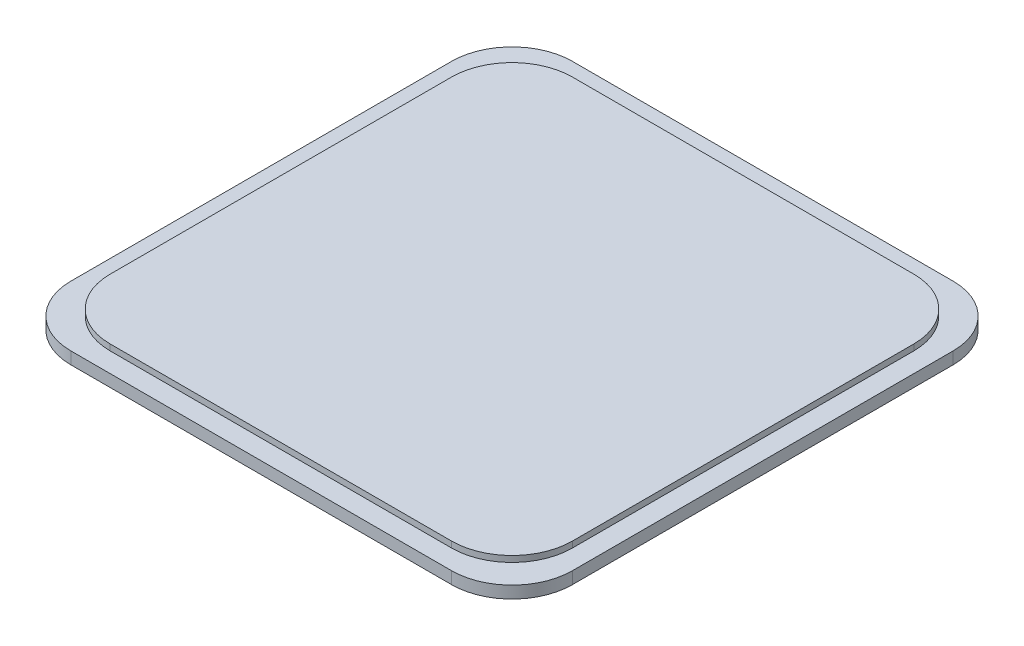
from build123d import *

# Parameters (mm, degrees)
BOSS_EXTRUDE1_DEPTH = 2
BOSS_EXTRUDE2_DEPTH = 1


with BuildPart() as part:
    # Sketch1 → Boss-Extrude1 (new body)
    with BuildSketch(Plane(origin=(0, 0, 0), x_dir=(1, 0, 0), z_dir=(0, 1, 0))):
        with BuildLine():
            Line((-31.5, 41.5), (31.5, 41.5))
            ThreePointArc((31.5, 41.5), (38.571067812, 38.571067812), (41.5, 31.5))
            Line((41.5, 31.5), (41.5, -31.5))
            ThreePointArc((41.5, -31.5), (38.571067812, -38.571067812), (31.5, -41.5))
            Line((31.5, -41.5), (-31.5, -41.5))
            ThreePointArc((-31.5, -41.5), (-38.571067812, -38.571067812), (-41.5, -31.5))
            Line((-41.5, -31.5), (-41.5, 31.5))
            ThreePointArc((-41.5, 31.5), (-38.571067812, 38.571067812), (-31.5, 41.5))
        make_face()
    extrude(amount=BOSS_EXTRUDE1_DEPTH)

    # Sketch2 → Boss-Extrude2 (add)
    with BuildSketch(Plane(origin=(0, 2, 0), x_dir=(1, 0, 0), z_dir=(0, 1, 0))):
        with BuildLine():
            Line((-28.25, 38.25), (28.25, 38.25))
            ThreePointArc((28.25, 38.25), (35.321067812, 35.321067812), (38.25, 28.25))
            Line((38.25, 28.25), (38.25, -28.25))
            ThreePointArc((38.25, -28.25), (35.321067812, -35.321067812), (28.25, -38.25))
            Line((28.25, -38.25), (-28.25, -38.25))
            ThreePointArc((-28.25, -38.25), (-35.321067812, -35.321067812), (-38.25, -28.25))
            Line((-38.25, -28.25), (-38.25, 28.25))
            ThreePointArc((-38.25, 28.25), (-35.321067812, 35.321067812), (-28.25, 38.25))
        make_face()
    extrude(amount=BOSS_EXTRUDE2_DEPTH)


solid = part.part
